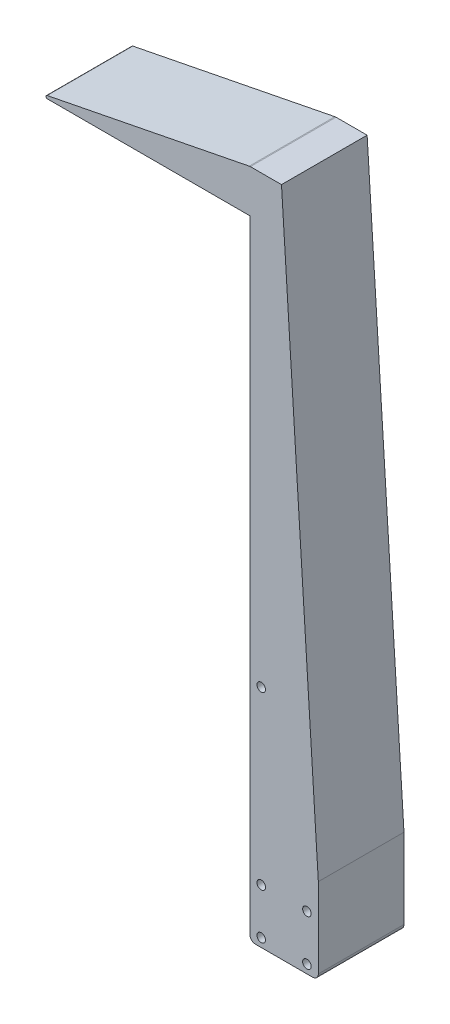
from build123d import *

# Parameters (mm, degrees)
SKETCH_1_R          = 1.5
EXTRUDE_1_DEPTH     = 30
SKETCH_2_R          = 1.5
CUT_EXTRUDE_1_DEPTH = 248.428255263
CUT_EXTRUDE_2_DEPTH = 248.428255263
SKETCH_4_R          = 1.5
CUT_EXTRUDE_3_DEPTH = 248.428255263


with BuildPart() as part:
    # 草图1 → 凸台-拉伸1 (new body)
    with BuildSketch(Plane.XY):
        with BuildLine():
            Line((2, 0), (22, 0))
            ThreePointArc((22, 0), (23.414213562, 0.585786438), (24, 2))
            Line((24, 2), (24, 220))
            Line((24, 220), (24, 233))
            ThreePointArc((24, 233), (23.414213562, 234.414213562), (22, 235))
            Line((22, 235), (0.195482884, 235))
            ThreePointArc((0.195482884, 235), (0.000927124, 234.990514521), (-0.19178318, 234.962148057))
            Line((-0.19178318, 234.962148057), (-70.981279128, 220.990537014))
            ThreePointArc((-70.981279128, 220.990537014), (-71.382091243, 220.45136106), (-70.884462612, 220))
            Line((-70.884462612, 220), (0, 220))
            Line((0, 220), (0, 2))
            ThreePointArc((0, 2), (0.585786438, 0.585786438), (2, 0))
        make_face()
        with Locations((20, 3)):
            Circle(SKETCH_1_R, mode=Mode.SUBTRACT)
        with Locations((4, 3)):
            Circle(SKETCH_1_R, mode=Mode.SUBTRACT)
        with Locations((4, 19)):
            Circle(SKETCH_1_R, mode=Mode.SUBTRACT)
    extrude(amount=EXTRUDE_1_DEPTH)

    # 草图2 → 切除-拉伸1 (cut, through all)
    with BuildSketch(Plane.XY.offset(30)):
        with Locations((20, 19)):
            Circle(SKETCH_2_R)
    extrude(amount=-CUT_EXTRUDE_1_DEPTH, mode=Mode.SUBTRACT)

    # 草图3 → 切除-拉伸2 (cut, through all)
    with BuildSketch(Plane(origin=(0, 0, 0), x_dir=(-1, 0, 0), z_dir=(0, 0, -1))):
        Polygon((-24, 30), (-11.097741442, 235), (-26.866932521, 235), align=None)
    extrude(amount=-CUT_EXTRUDE_2_DEPTH, mode=Mode.SUBTRACT)

    # 草图4 → 切除-拉伸3 (cut, through all)
    with BuildSketch(Plane(origin=(0, 0, 0), x_dir=(-1, 0, 0), z_dir=(0, 0, -1))):
        with Locations((-4, 79)):
            Circle(SKETCH_4_R)
    extrude(amount=-CUT_EXTRUDE_3_DEPTH, mode=Mode.SUBTRACT)


solid = part.part
